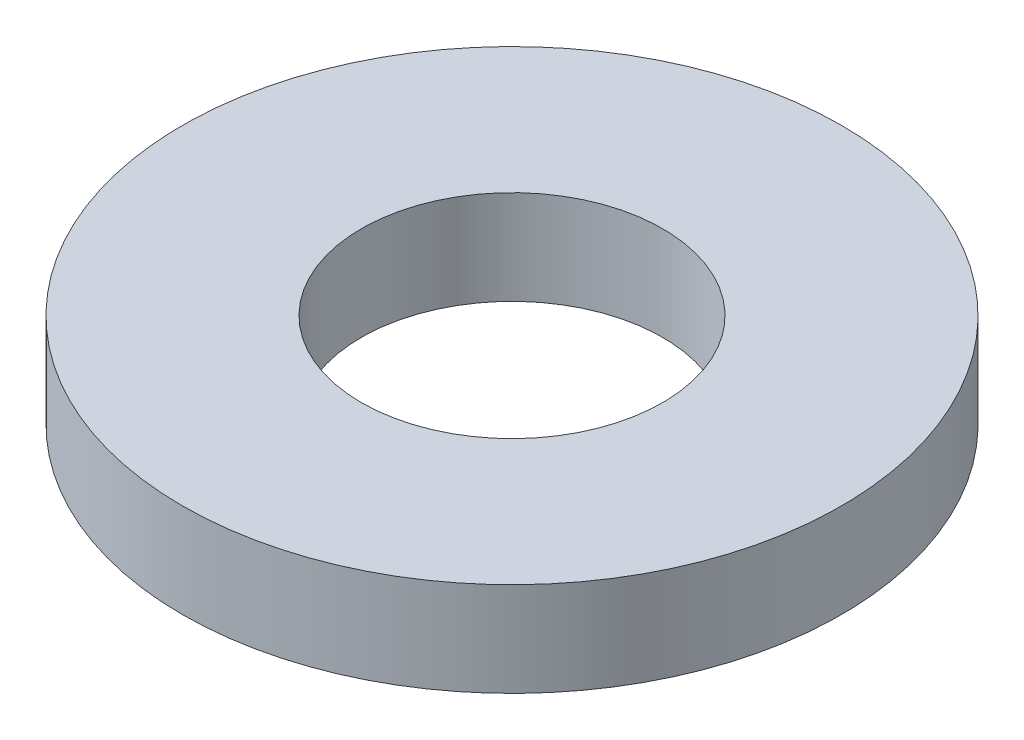
from build123d import *

# Parameters (mm, degrees)
SKETCH3_R           = 3.5
SKETCH3_R_2         = 1.6
BOSS_EXTRUDE1_DEPTH = 1


with BuildPart() as part:
    # Sketch3 → Boss-Extrude1 (new body)
    with BuildSketch(Plane(origin=(0, 0, 0), x_dir=(1, 0, 0), z_dir=(0, 1, 0))):
        with Locations(Location((0, 0, 0), (0, 0, 270))):
            Circle(SKETCH3_R)
        with Locations(Location((0, 0, 0), (0, 0, 270))):
            Circle(SKETCH3_R_2, mode=Mode.SUBTRACT)
    extrude(amount=BOSS_EXTRUDE1_DEPTH)


solid = part.part
